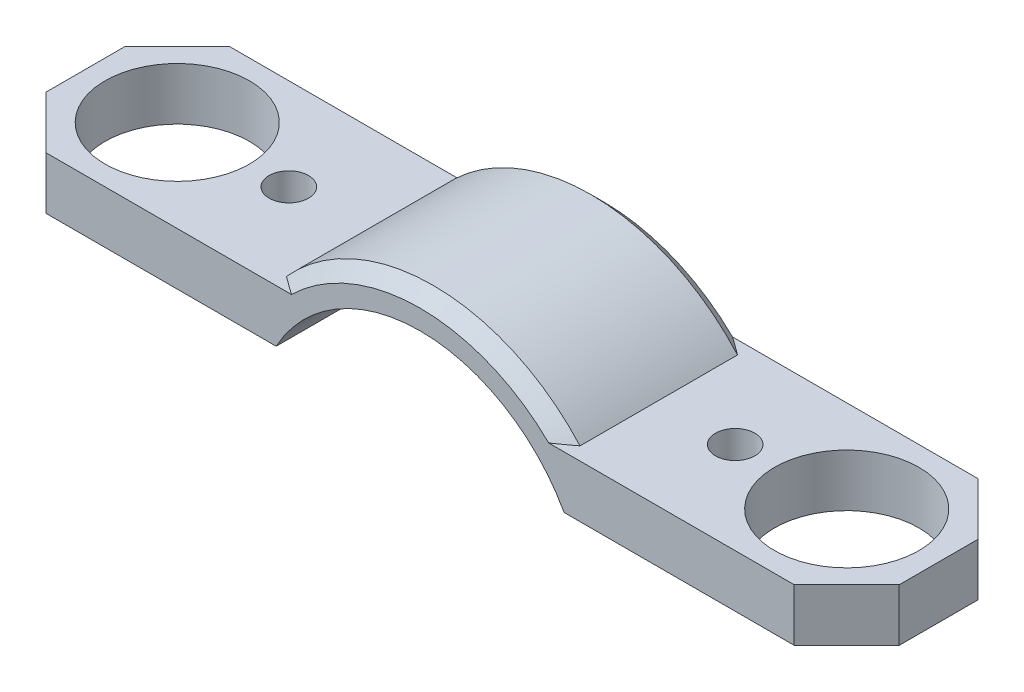
from build123d import *

# Parameters (mm, degrees)
ESQUISSE2_W             = 65
ESQUISSE2_H             = 14
BOSS_EXTRU_1_DEPTH      = 4
ESQUISSE3_R             = 5.5
ESQUISSE3_R_2           = 1.5
ENL_V_MAT_EXTRU_1_DEPTH = 4
BOSS_EXTRU_3_DEPTH      = 14
ESQUISSE7_R             = 12.5
ENL_V_MAT_EXTRU_4_DEPTH = 39.788005272
CHANFREIN1_SIZE         = 4
CHANFREIN2_SIZE         = 1


with BuildPart() as part:
    # Esquisse2 → Boss.-Extru.1 (new body)
    with BuildSketch(Plane(origin=(0, 0, 0), x_dir=(1, 0, 0), z_dir=(0, 1, 0))):
        with Locations((-3.326098768, -2.352831094)):
            Rectangle(ESQUISSE2_W, ESQUISSE2_H)
    extrude(amount=-BOSS_EXTRU_1_DEPTH)

    # Esquisse3 → Enlèv. mat.-Extru.1 (cut)
    with BuildSketch(Plane.XZ.offset(4)):
        with Locations(Location((-28.826098768, 2.352831094, 0), (0, 0, 270))):
            Circle(ESQUISSE3_R)
        with Locations(Location((22.173901232, 2.352831094, 0), (0, 0, 270))):
            Circle(ESQUISSE3_R)
        with Locations(Location((-20.326098768, 2.352831094, 0), (0, 0, 270))):
            Circle(ESQUISSE3_R_2)
        with Locations(Location((13.673901232, 2.352831094, 0), (0, 0, 270))):
            Circle(ESQUISSE3_R_2)
    extrude(amount=-ENL_V_MAT_EXTRU_1_DEPTH, mode=Mode.SUBTRACT)

    # Esquisse5 → Boss.-Extru.3 (add)
    with BuildSketch(Plane(origin=(0, 0, -4.647168906), x_dir=(-1, 0, 0), z_dir=(0, 0, -1))):
        with BuildLine():
            Line((-10.421628317, -4), (17.073825853, -4))
            ThreePointArc((17.073825853, -4), (3.326098768, 5), (-10.421628317, -4))
        make_face()
    extrude(amount=-BOSS_EXTRU_3_DEPTH)

    # Esquisse7 → Enlèv. mat.-Extru.4 (cut, through all)
    with BuildSketch(Plane(origin=(0, 0, -4.647168906), x_dir=(-1, 0, 0), z_dir=(0, 0, -1))):
        with Locations((3.326098768, -10)):
            Circle(ESQUISSE7_R)
    extrude(amount=-ENL_V_MAT_EXTRU_4_DEPTH, mode=Mode.SUBTRACT)

    # Chanfrein1
    chanfrein1_edges = [part.edges().sort_by_distance(p)[0] for p in [
        (-35.826098768, -2, -4.647168906),
        (29.173901232, -2, -4.647168906),
        (29.173901232, -2, 9.352831094),
        (-35.826098768, -2, 9.352831094),
    ]]
    chamfer(chanfrein1_edges, length=CHANFREIN1_SIZE)

    # Chanfrein2
    chanfrein2_edges = [part.edges().sort_by_distance(p)[0] for p in [
        (-3.326098768, 5, 9.352831094),
        (-3.326098768, 5, -4.647168906),
    ]]
    chamfer(chanfrein2_edges, length=CHANFREIN2_SIZE)


solid = part.part
